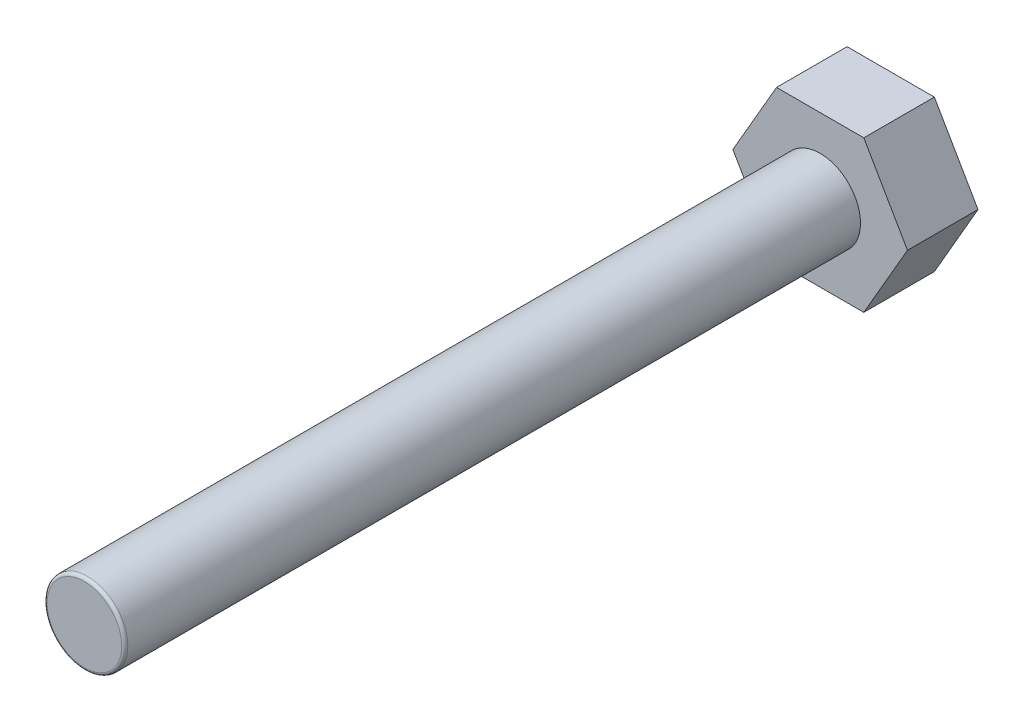
from build123d import *

# Parameters (mm, degrees)
CROQUIS1_R              = 4
SALIENTE_EXTRUIR1_DEPTH = 80
CROQUIS1_3_R            = 4
SALIENTE_EXTRUIR2_DEPTH = 7
REDONDEO1_R             = 0.3


with BuildPart() as part:
    # Croquis1 → Saliente-Extruir1 (new body)
    with BuildSketch(Plane.XY):
        Circle(CROQUIS1_R)
    extrude(amount=SALIENTE_EXTRUIR1_DEPTH)

    # Croquis1<3> → Saliente-Extruir2 (add)
    with BuildSketch(Plane.XY):
        Polygon((-4.330127019, -7.5), (4.330127019, -7.5), (8.660254038, 0), (4.330127019, 7.5), (-4.330127019, 7.5), (-8.660254038, 0), align=None)
        Circle(CROQUIS1_3_R, mode=Mode.SUBTRACT)
    extrude(amount=SALIENTE_EXTRUIR2_DEPTH)

    # Redondeo1
    redondeo1_edges = [part.edges().sort_by_distance(p)[0] for p in [
        (-4, 0, 80),
    ]]
    fillet(redondeo1_edges, radius=REDONDEO1_R)


solid = part.part
